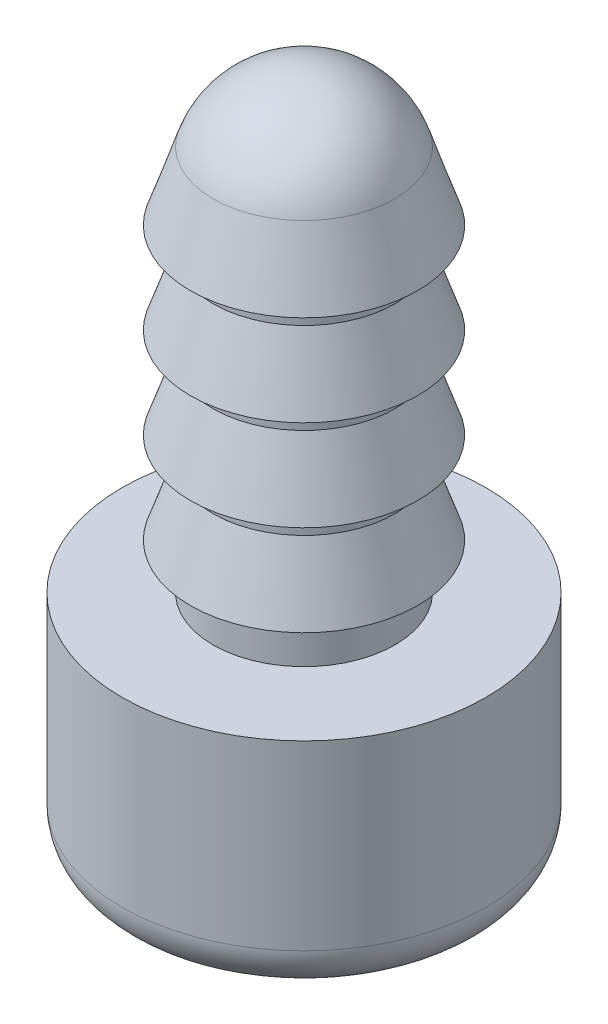
from build123d import *

# Parameters (mm, degrees)
FILLET_1_R = 2


with BuildPart() as part:
    # 草图1 → 旋转1 (revolve)
    with BuildSketch(Plane.XY, mode=Mode.PRIVATE) as revolve_1_sk:
        with BuildLine():
            Line((0, 1), (0, -28.88303688))
            Line((0, -28.88303688), (8, -28.88303688))
            Line((8, -28.88303688), (8, -18.88303688))
            Line((8, -18.88303688), (4, -18.88303688))
            Line((4, -18.88303688), (4, -15.88303688))
            Line((4, -15.88303688), (5, -16.88303688))
            Line((5, -16.88303688), (4, -13.88303688))
            Line((4, -13.88303688), (4, -11.88303688))
            Line((4, -11.88303688), (5, -12.88303688))
            Line((5, -12.88303688), (4, -9.88303688))
            Line((4, -9.88303688), (4, -7.88303688))
            Line((4, -7.88303688), (5, -8.88303688))
            Line((5, -8.88303688), (4, -5.88303688))
            Line((4, -5.88303688), (4, -3.88303688))
            Line((4, -3.88303688), (5, -4.88303688))
            Line((5, -4.88303688), (4, -1.88303688))
            ThreePointArc((4, -1.88303688), (2.465355028, 0.204127172), (0, 1))
        make_face()
    revolve(revolve_1_sk.sketch.rotate(Axis((0, 13.407424858, 0), (0, -1, 0)), 90), axis=Axis((0, 13.407424858, 0), (0, -1, 0)))

    # 圆角1
    fillet_1_edges = [part.edges().sort_by_distance(p)[0] for p in [
        (0, -28.88303688, -8),
    ]]
    fillet(fillet_1_edges, radius=FILLET_1_R)


solid = part.part
